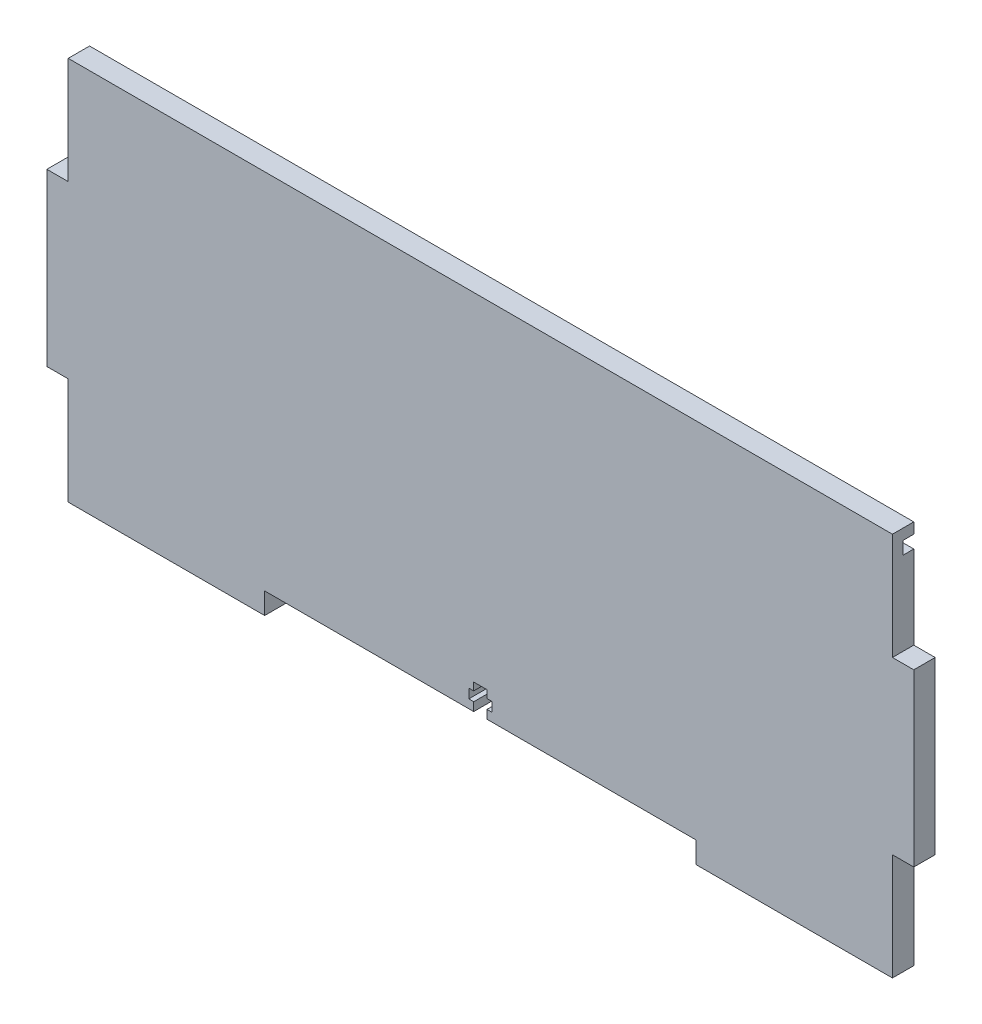
from build123d import *

# Parameters (mm, degrees)
SKETCH1_W           = 203
SKETCH1_H           = 90
BOSS_EXTRUDE1_DEPTH = 5
SKETCH3_W           = 5
SKETCH3_H           = 25
SKETCH3_W_2         = 101
SKETCH3_H_2         = 5
CUT_EXTRUDE2_DEPTH  = 223.112584065
SKETCH4_W           = 193
SKETCH4_H           = 3
CUT_EXTRUDE3_DEPTH  = 2.5
SKETCH5_W           = 3.1
SKETCH5_H           = 1.8
SKETCH5_W_2         = 1.15
SKETCH5_H_2         = 2.2
SKETCH5_H_3         = 2
CUT_EXTRUDE4_DEPTH  = 223.112584065


with BuildPart() as part:
    # Sketch1 → Boss-Extrude1 (new body)
    with BuildSketch(Plane.XY):
        with Locations((101.5, 45)):
            Rectangle(SKETCH1_W, SKETCH1_H)
    extrude(amount=BOSS_EXTRUDE1_DEPTH)

    # Sketch3 → Cut-Extrude2 (cut, through all)
    with BuildSketch(Plane(origin=(0, 0, 0), x_dir=(-1, 0, 0), z_dir=(0, 0, -1))):
        with Locations((-200.5, 12.5)):
            Rectangle(SKETCH3_W, SKETCH3_H)
        with Locations((-200.5, 77.5)):
            Rectangle(SKETCH3_W, SKETCH3_H)
        with Locations((-2.5, 12.5)):
            Rectangle(SKETCH3_W, SKETCH3_H)
        with Locations((-2.5, 77.5)):
            Rectangle(SKETCH3_W, SKETCH3_H)
        with Locations((-101.5, 2.5)):
            Rectangle(SKETCH3_W_2, SKETCH3_H_2)
    extrude(amount=-CUT_EXTRUDE2_DEPTH, mode=Mode.SUBTRACT)

    # Sketch4 → Cut-Extrude3 (cut)
    with BuildSketch(Plane(origin=(0, 0, 0), x_dir=(-1, 0, 0), z_dir=(0, 0, -1))):
        with Locations((-101.5, 86)):
            Rectangle(SKETCH4_W, SKETCH4_H)
    extrude(amount=-CUT_EXTRUDE3_DEPTH, mode=Mode.SUBTRACT)

    # Sketch5 → Cut-Extrude4 (cut, through all)
    with BuildSketch(Plane(origin=(0, 0, 0), x_dir=(-1, 0, 0), z_dir=(0, 0, -1))):
        with Locations((-101.5, 10.1)):
            Rectangle(SKETCH5_W, SKETCH5_H)
        with Locations((-103.625, 8.1)):
            Rectangle(SKETCH5_W_2, SKETCH5_H_2)
        with Locations((-101.5, 8.1)):
            Rectangle(SKETCH5_W, SKETCH5_H_2)
        with Locations((-99.375, 8.1)):
            Rectangle(SKETCH5_W_2, SKETCH5_H_2)
        with Locations((-101.5, 6)):
            Rectangle(SKETCH5_W, SKETCH5_H_3)
    extrude(amount=-CUT_EXTRUDE4_DEPTH, mode=Mode.SUBTRACT)


solid = part.part
